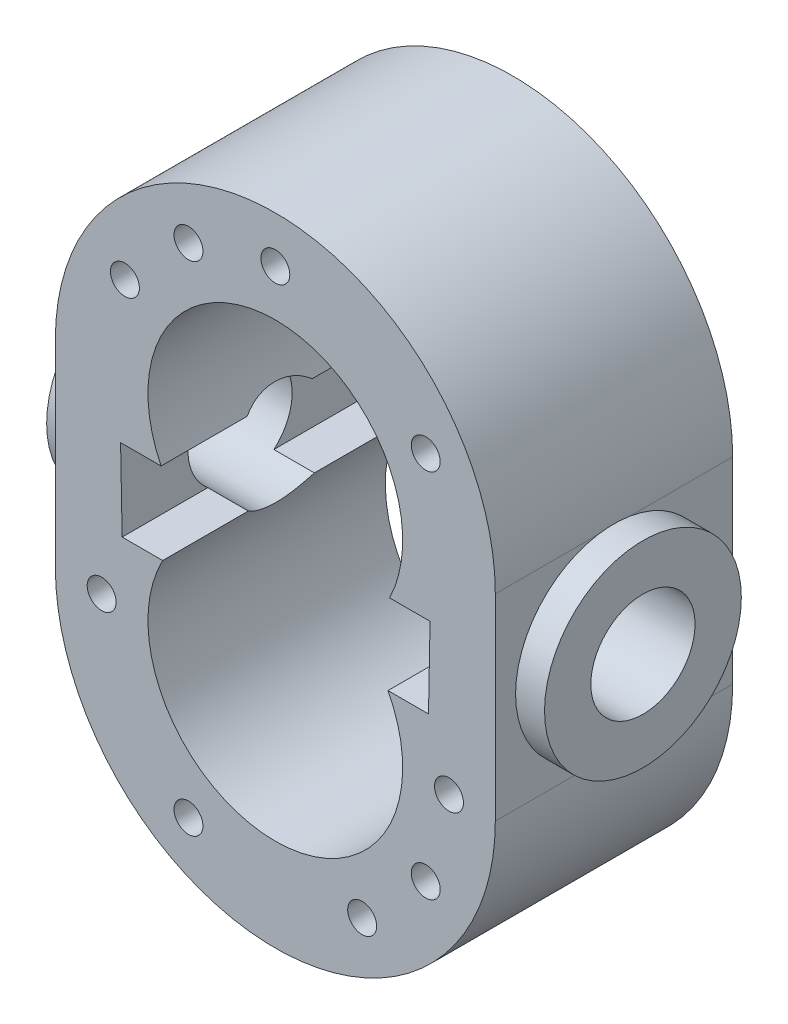
from build123d import *

# Parameters (mm, degrees)
EXTRUDE_1_DEPTH           = 41
SKETCH_3_R                = 17
SKETCH_3_R_2              = 9
EXTRUDE_3_DEPTH           = 5
CUT_EXTRUDE_START         = -76
SKETCH_6_R                = 9
CUT_EXTRUDE_1_DEPTH       = 76
EXTRUDE_START             = 5
SKETCH_7_R                = 17
SKETCH_7_R_2              = 9
EXTRUDE_4_DEPTH           = 5
HOLE_WIZARD_M6_1_D        = 5
HOLE_WIZARD_M6_1_DEPTH    = 17
HOLE_WIZARD_M6_1_TIP      = 1.502151548
HOLE_WIZARD_5_0_5_1_D     = 5
HOLE_WIZARD_5_0_5_1_DEPTH = 5
HOLE_WIZARD_5_0_5_1_TIP   = 1.502151548
HOLE_WIZARD_M6_2_D        = 5
HOLE_WIZARD_M6_2_DEPTH    = 17
HOLE_WIZARD_M6_2_TIP      = 1.502151548
HOLE_WIZARD_5_0_5_2_D     = 5
HOLE_WIZARD_5_0_5_2_DEPTH = 17
HOLE_WIZARD_5_0_5_2_TIP   = 1.502151548


with BuildPart() as part:
    # 草图1 → 凸台-拉伸1 (new body)
    with BuildSketch(Plane.XY):
        with BuildLine():
            Line((38, 16.731473276), (38, -17.268526724))
            ThreePointArc((38, -17.268526724), (0, -55.268526724), (-38, -17.268526724))
            Line((-38, -17.268526724), (-38, 16.731473276))
            ThreePointArc((-38, 16.731473276), (0, 54.731473276), (38, 16.731473276))
        make_face()
        with BuildLine():
            Line((-19.73064692, 7), (-26.73064692, 7))
            Line((-26.73064692, 7), (-26.45655054, -7))
            Line((-26.45655054, -7), (-19.45655054, -7))
            ThreePointArc((-19.45655054, -7), (0, -39.268526724), (19.45655054, -7))
            Line((19.45655054, -7), (26.45655054, -7))
            Line((26.45655054, -7), (26.73064692, 7))
            Line((26.73064692, 7), (19.73064692, 7))
            ThreePointArc((19.73064692, 7), (0, 38.731473276), (-19.73064692, 7))
        make_face(mode=Mode.SUBTRACT)
    extrude(amount=EXTRUDE_1_DEPTH)

    # 草图3 → 凸台-拉伸3 (add)
    with BuildSketch(Plane.ZY.offset(38)):
        with Locations(Location((20.5, -0.04055331, 0), (0, 0, 99.3938106))):
            Circle(SKETCH_3_R)
        with Locations((20.5, -0.04055331)):
            Circle(SKETCH_3_R_2, mode=Mode.SUBTRACT)
    extrude(amount=EXTRUDE_3_DEPTH)

    # 草图6 → 切除-拉伸1 (cut)
    with BuildSketch(Plane.ZY.offset(38).offset(CUT_EXTRUDE_START)):
        with Locations(Location((20.5, -0.04055331, 0), (0, 0, 230.648614593))):
            Circle(SKETCH_6_R)
    extrude(amount=CUT_EXTRUDE_1_DEPTH, mode=Mode.SUBTRACT)

    # 草图7 → 凸台-拉伸4 (add)
    with BuildSketch(Plane(origin=(38, 0, 0), x_dir=(0, 0, -1), z_dir=(1, 0, 0)).offset(EXTRUDE_START)):
        with Locations(Location((-20.5, -0.04055331, 0), (0, 0, 80.6061894))):
            Circle(SKETCH_7_R)
        with Locations(Location((-20.5, -0.04055331, 0), (0, 0, 309.351385407))):
            Circle(SKETCH_7_R_2, mode=Mode.SUBTRACT)
    extrude(amount=-EXTRUDE_4_DEPTH)

    # M6 螺纹孔1
    with Locations(Plane(origin=(0, 47.027832747, 0), x_dir=(-1, 0, 0), z_dir=(0, 0, -1))):
        with Locations((0, 0), (-25.980762114, -15.296359471), (-28.977774789, -72.060930824), (0, -94.296359471), (28.977774789, -72.060930824), (25.980762114, -15.296359471)):
            Hole(HOLE_WIZARD_M6_1_D / 2, depth=HOLE_WIZARD_M6_1_DEPTH)
            with Locations((0, 0, -(HOLE_WIZARD_M6_1_DEPTH + HOLE_WIZARD_M6_1_TIP / 2))):  # 118° drill point
                Cone(0, HOLE_WIZARD_M6_1_D / 2, HOLE_WIZARD_M6_1_TIP, mode=Mode.SUBTRACT)

    # Ø5.0 (5) 直径孔1
    with Locations(Plane(origin=(15, 42.71223539, 0), x_dir=(-1, 0, 0), z_dir=(0, 0, -1))):
        with Locations((0, 0), (30, -85.961524227)):
            Hole(HOLE_WIZARD_5_0_5_1_D / 2, depth=HOLE_WIZARD_5_0_5_1_DEPTH)
            with Locations((0, 0, -(HOLE_WIZARD_5_0_5_1_DEPTH + HOLE_WIZARD_5_0_5_1_TIP / 2))):  # 118° drill point
                Cone(0, HOLE_WIZARD_5_0_5_1_D / 2, HOLE_WIZARD_5_0_5_1_TIP, mode=Mode.SUBTRACT)

    # M6 螺纹孔2
    with Locations(Plane(origin=(0, 46.731473276, 41), x_dir=(1, 0, 0), z_dir=(0, 0, 1))):
        with Locations((0, 0), (-25.980762114, -15), (25.980762114, -15), (30, -64), (-30, -64), (-15, -89.980762113), (15, -89.980762113)):
            Hole(HOLE_WIZARD_M6_2_D / 2, depth=HOLE_WIZARD_M6_2_DEPTH)
            with Locations((0, 0, -(HOLE_WIZARD_M6_2_DEPTH + HOLE_WIZARD_M6_2_TIP / 2))):  # 118° drill point
                Cone(0, HOLE_WIZARD_M6_2_D / 2, HOLE_WIZARD_M6_2_TIP, mode=Mode.SUBTRACT)

    # Ø5.0 (5) 直径孔2
    with Locations(Plane(origin=(-15, 42.71223539, 41), x_dir=(1, 0, 0), z_dir=(0, 0, 1))):
        with Locations((0, 0), (40.980762114, -74.980762114)):
            Hole(HOLE_WIZARD_5_0_5_2_D / 2, depth=HOLE_WIZARD_5_0_5_2_DEPTH)
            with Locations((0, 0, -(HOLE_WIZARD_5_0_5_2_DEPTH + HOLE_WIZARD_5_0_5_2_TIP / 2))):  # 118° drill point
                Cone(0, HOLE_WIZARD_5_0_5_2_D / 2, HOLE_WIZARD_5_0_5_2_TIP, mode=Mode.SUBTRACT)


solid = part.part
